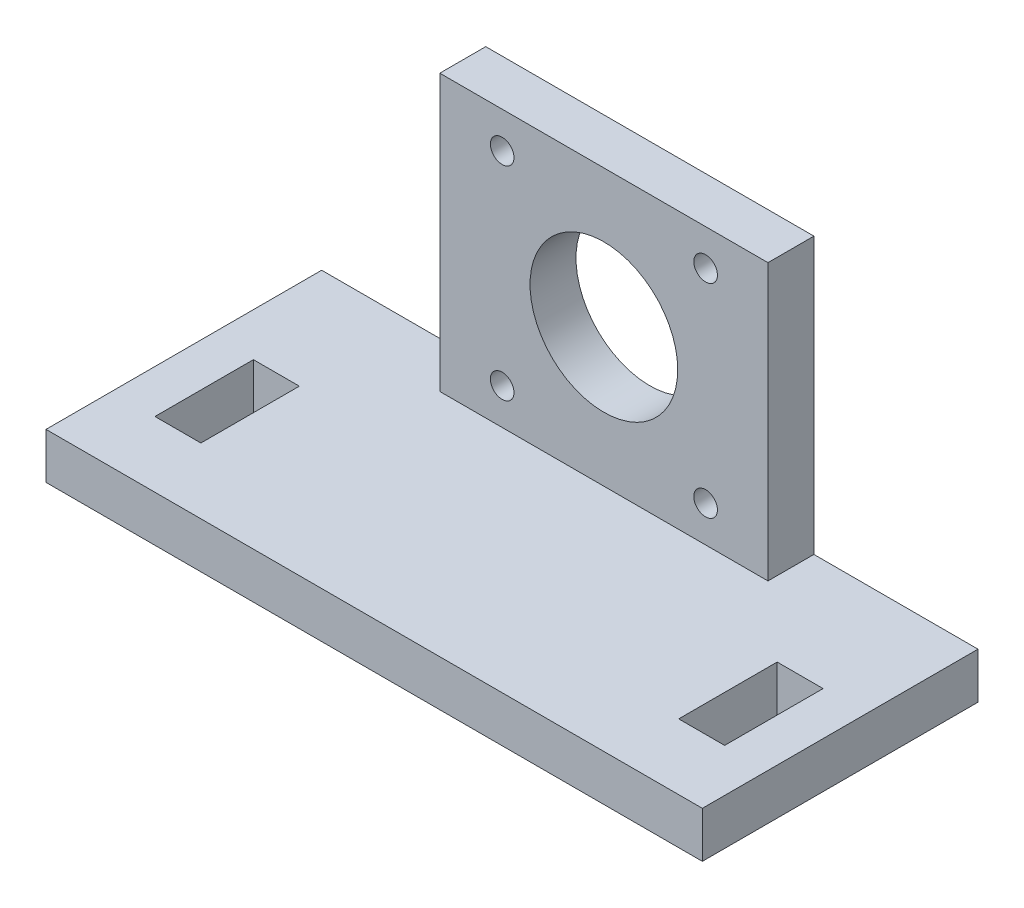
from build123d import *

# Parameters (mm, degrees)
SKETCH1_W           = 50
SKETCH1_H           = 42
BOSS_EXTRUDE1_DEPTH = 49
SKETCH2_W           = 50
SKETCH2_H           = 35
CUT_EXTRUDE1_DEPTH  = 42
SKETCH3_W           = 42
SKETCH3_H           = 7
BOSS_EXTRUDE2_DEPTH = 25
SKETCH4_W           = 42
SKETCH4_H           = 7
BOSS_EXTRUDE3_DEPTH = 25
SKETCH5_R           = 11.25
SKETCH5_R_2         = 1.8
CUT_EXTRUDE2_DEPTH  = 79.268767717
SKETCH6_W           = 7
SKETCH6_H           = 15
CUT_EXTRUDE3_DEPTH  = 69.593002559


with BuildPart() as part:
    # Sketch1 → Boss-Extrude1 (new body)
    with BuildSketch(Plane(origin=(0, 0, 0), x_dir=(1, 0, 0), z_dir=(0, 1, 0))):
        Rectangle(SKETCH1_W, SKETCH1_H)
    extrude(amount=BOSS_EXTRUDE1_DEPTH)

    # Sketch2 → Cut-Extrude1 (cut)
    with BuildSketch(Plane(origin=(0, 49, 0), x_dir=(1, 0, 0), z_dir=(0, 1, 0))):
        with Locations((0, -3.5)):
            Rectangle(SKETCH2_W, SKETCH2_H)
    extrude(amount=-CUT_EXTRUDE1_DEPTH, mode=Mode.SUBTRACT)

    # Sketch3 → Boss-Extrude2 (add)
    with BuildSketch(Plane(origin=(25, 0, 0), x_dir=(0, 0, -1), z_dir=(1, 0, 0))):
        with Locations((0, 3.5)):
            Rectangle(SKETCH3_W, SKETCH3_H)
    extrude(amount=BOSS_EXTRUDE2_DEPTH)

    # Sketch4 → Boss-Extrude3 (add)
    with BuildSketch(Plane.ZY.offset(25)):
        with Locations((0, 3.5)):
            Rectangle(SKETCH4_W, SKETCH4_H)
    extrude(amount=BOSS_EXTRUDE3_DEPTH)

    # Sketch5 → Cut-Extrude2 (cut, through all)
    with BuildSketch(Plane.XY.offset(-14)):
        with Locations((0, 28)):
            Circle(SKETCH5_R)
        with Locations((-15.5, 43.5)):
            Circle(SKETCH5_R_2)
        with Locations((15.5, 43.5)):
            Circle(SKETCH5_R_2)
        with Locations((-15.5, 12.5)):
            Circle(SKETCH5_R_2)
        with Locations((15.5, 12.5)):
            Circle(SKETCH5_R_2)
    extrude(amount=-CUT_EXTRUDE2_DEPTH, mode=Mode.SUBTRACT)

    # Sketch6 → Cut-Extrude3 (cut, through all)
    with BuildSketch(Plane(origin=(0, 7, 0), x_dir=(1, 0, 0), z_dir=(0, 1, 0))):
        with Locations((-39.9, -3.5)):
            Rectangle(SKETCH6_W, SKETCH6_H)
        with Locations((39.9, -3.5)):
            Rectangle(SKETCH6_W, SKETCH6_H)
    extrude(amount=-CUT_EXTRUDE3_DEPTH, mode=Mode.SUBTRACT)


solid = part.part
